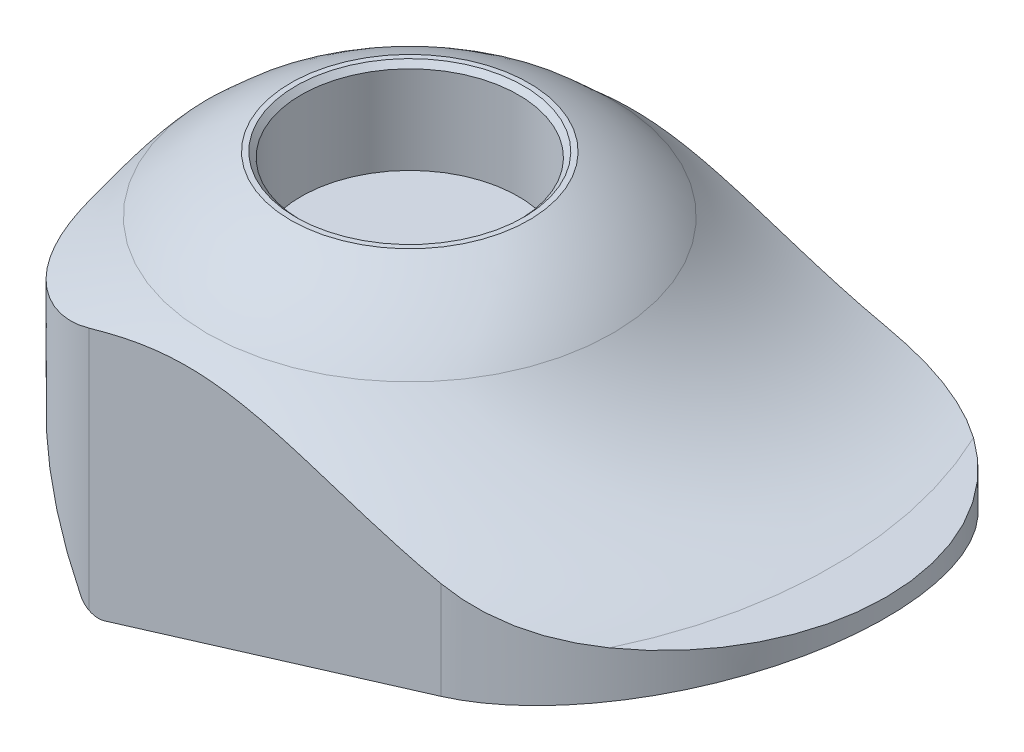
from build123d import *

# Parameters (mm, degrees)
IZIM2_OUTSIDE_W                      = 120.946
IZIM2_OUTSIDE_H                      = 120.946
KES_EKSTR_ZYON1_DEPTH                = 40
IZIM3_OUTSIDE_W                      = 84.664
IZIM3_OUTSIDE_H                      = 54.164
KES_EKSTR_ZYON2_DEPTH                = 30
Y_KSEKLIK_EKSTR_ZYON2_START          = 9
IZIM11_R                             = 10.5
Y_KSEKLIK_EKSTR_ZYON2_DEPTH          = 9
M8X1_25_DI_LI_DELIK1_D               = 6.8
M8X1_25_DI_LI_DELIK1_DEPTH           = 18
M8X1_25_DI_LI_DELIK1_TIP             = 2.042926105
M8X1_25_DI_LI_DELIK2_D               = 6.8
M8X1_25_DI_LI_DELIK2_DEPTH           = 12
M8X1_25_DI_LI_DELIK2_TIP             = 2.042926105
M8X1_25_DI_LI_DELIK2_ON_FACE_2_D     = 6.8
M8X1_25_DI_LI_DELIK2_ON_FACE_2_DEPTH = 12
M8X1_25_DI_LI_DELIK2_ON_FACE_2_TIP   = 2.042926105
KES_EKSTR_ZYON3_DEPTH                = 7


with BuildPart() as part:
    # Çizim1 → Döndür1 (revolve)
    with BuildSketch(Plane.XY, mode=Mode.PRIVATE) as d_nd_r1_sk:
        with BuildLine():
            Line((0, -35), (0, -18))
            Line((0, -18), (8.5, -18))
            Line((8.5, -18), (8.5, -9))
            Line((8.5, -9), (10.5, -9))
            Line((10.5, -9), (10.5, -0.5))
            Line((10.5, -0.5), (11, 0))
            Line((11, 0), (11.5, 0))
            ThreePointArc((11.5, 0), (15.803393463, -2.321536849), (19.572591816, -5.436319733))
            ThreePointArc((19.572591816, -5.436319733), (29.328522406, -11.988638081), (40.852954694, -14.290489038))
            Line((40.852954694, -14.290489038), (46, -14.290489038))
            Line((46, -14.290489038), (46, -35))
            Line((46, -35), (0, -35))
        make_face()
    revolve(d_nd_r1_sk.sketch.rotate(Axis((0, 4.884743134, 0), (0, -1, 0)), 90), axis=Axis((0, 4.884743134, 0), (0, -1, 0)))

    # Çizim2 outside → Kes-Ekstrüzyon1 (cut)
    with BuildSketch(Plane(origin=(0, 0, 0), x_dir=(1, 0, 0), z_dir=(0, 1, 0))):
        Rectangle(IZIM2_OUTSIDE_W, IZIM2_OUTSIDE_H)
        with BuildLine():
            Line((-19.5, 11.5), (-19.5, -11.5))
            ThreePointArc((-19.5, -11.5), (-16.571067812, -18.571067812), (-9.5, -21.5))
            Line((-9.5, -21.5), (24.5, -21.5))
            ThreePointArc((24.5, -21.5), (46, 0), (24.5, 21.5))
            Line((24.5, 21.5), (-9.5, 21.5))
            ThreePointArc((-9.5, 21.5), (-16.571067812, 18.571067812), (-19.5, 11.5))
        make_face(mode=Mode.SUBTRACT)
    extrude(amount=-KES_EKSTR_ZYON1_DEPTH, mode=Mode.SUBTRACT)

    # Çizim3 outside → Kes-Ekstrüzyon2 (cut, symmetric)
    with BuildSketch(Plane.XY):
        with Locations((13.25, -17.5)):
            Rectangle(IZIM3_OUTSIDE_W, IZIM3_OUTSIDE_H)
        with BuildLine():
            Line((-19.5, -13), (-19.5, -5.36356579))
            ThreePointArc((-19.5, -5.36356579), (-15.760740466, -2.292876744), (-11.5, 0))
            Line((-11.5, 0), (11.5, 0))
            ThreePointArc((11.5, 0), (15.803393463, -2.321536849), (19.572591816, -5.436319733))
            ThreePointArc((19.572591816, -5.436319733), (29.328522406, -11.988638081), (40.852954694, -14.290489038))
            Line((40.852954694, -14.290489038), (46, -14.290489038))
            Line((46, -14.290489038), (46, -16.000690448))
            Line((46, -16.000690448), (-7.993980308, -32.508306842))
            ThreePointArc((-7.993980308, -32.508306842), (-9.31172617, -32.456532466), (-10.310774525, -31.59569733))
            Line((-10.310774525, -31.59569733), (-18.160254038, -18))
            ThreePointArc((-18.160254038, -18), (-19.159258263, -15.588190451), (-19.5, -13))
        make_face(mode=Mode.SUBTRACT)
    extrude(amount=KES_EKSTR_ZYON2_DEPTH, both=True, mode=Mode.SUBTRACT)

    # Çizim11 → Yükseklik-Ekstrüzyon2 (add)
    with BuildSketch(Plane(origin=(0, -18, 0), x_dir=(1, 0, 0), z_dir=(0, 1, 0)).offset(Y_KSEKLIK_EKSTR_ZYON2_START)):
        with Locations(Location((0, 0, 0), (0, 0, 270))):
            Circle(IZIM11_R)
    extrude(amount=-Y_KSEKLIK_EKSTR_ZYON2_DEPTH)

    # M8x1.25 Dişli Delik1
    with Locations(Plane(origin=(-0.844028469, -30.322347194, 0), x_dir=(-0.956304755963, -0.292371704723, 0), z_dir=(0.292371704723, -0.956304755963, 0))):
        with Locations((0, 0)):
            Hole(M8X1_25_DI_LI_DELIK1_D / 2, depth=M8X1_25_DI_LI_DELIK1_DEPTH)
            with Locations((0, 0, -(M8X1_25_DI_LI_DELIK1_DEPTH + M8X1_25_DI_LI_DELIK1_TIP / 2))):  # 118° drill point
                Cone(0, M8X1_25_DI_LI_DELIK1_D / 2, M8X1_25_DI_LI_DELIK1_TIP, mode=Mode.SUBTRACT)

    # M8x1.25 Dişli Delik2
    with Locations(Plane(origin=(21.70506177, -23.428398469, 12.310096913), x_dir=(-0.956304755963, -0.292371704723, 0), z_dir=(0.292371704723, -0.956304755963, 0))):
        with Locations((0, 0)):
            Hole(M8X1_25_DI_LI_DELIK2_D / 2, depth=M8X1_25_DI_LI_DELIK2_DEPTH)
            with Locations((0, 0, -(M8X1_25_DI_LI_DELIK2_DEPTH + M8X1_25_DI_LI_DELIK2_TIP / 2))):  # 118° drill point
                Cone(0, M8X1_25_DI_LI_DELIK2_D / 2, M8X1_25_DI_LI_DELIK2_TIP, mode=Mode.SUBTRACT)

    # M8x1.25 Dişli Delik2 on face 2
    with Locations(Plane(origin=(21.70506177, -23.428398469, -12.310096913), x_dir=(-0.956304694265, -0.292371906527, 0), z_dir=(0.292371906527, -0.956304694265, 0))):
        with Locations((0, 0)):
            Hole(M8X1_25_DI_LI_DELIK2_ON_FACE_2_D / 2, depth=M8X1_25_DI_LI_DELIK2_ON_FACE_2_DEPTH)
            with Locations((0, 0, -(M8X1_25_DI_LI_DELIK2_ON_FACE_2_DEPTH + M8X1_25_DI_LI_DELIK2_ON_FACE_2_TIP / 2))):  # 118° drill point
                Cone(0, M8X1_25_DI_LI_DELIK2_ON_FACE_2_D / 2, M8X1_25_DI_LI_DELIK2_ON_FACE_2_TIP, mode=Mode.SUBTRACT)

    # Çizim16 → Kes-Ekstrüzyon3 (cut)
    with BuildSketch(Plane(origin=(8.405872106, -27.494368788, 0), x_dir=(0.956304755963042, 0.2923717047227155, 0), z_dir=(0.29237170472271556, -0.9563047559630421, 0))):
        with BuildLine():
            Line((-16.172544779, -8.831760866), (-16.172544779, -15.810096913))
            ThreePointArc((-16.172544779, -15.810096913), (-15.293865123, -17.931417256), (-13.172544779, -18.810096913))
            Line((-13.172544779, -18.810096913), (5.075092134, -18.810096913))
            ThreePointArc((5.075092134, -18.810096913), (7.556602709, -17.495951373), (7.864069249, -14.704833755))
            ThreePointArc((7.864069249, -14.704833755), (9.081050216, -7.955601822), (15.670169023, -6.053842714))
            ThreePointArc((15.670169023, -6.053842714), (23.208480374, -0.112690383), (15.891078456, 6.098513866))
            ThreePointArc((15.891078456, 6.098513866), (15.779783551, 6.080333222), (15.670169023, 6.053842714))
            ThreePointArc((15.670169023, 6.053842714), (9.081050216, 7.955601822), (7.864069249, 14.704833755))
            ThreePointArc((7.864069249, 14.704833755), (7.556602709, 17.495951374), (5.075092134, 18.810096913))
            Line((5.075092134, 18.810096913), (-13.172544779, 18.810096913))
            ThreePointArc((-13.172544779, 18.810096913), (-15.293865123, 17.931417256), (-16.172544779, 15.810096913))
            Line((-16.172544779, 15.810096913), (-16.172544779, 8.831760866))
            ThreePointArc((-16.172544779, 8.831760866), (-14.85839924, 6.350250291), (-12.067281621, 6.042783751))
            ThreePointArc((-12.067281621, 6.042783751), (-3.172544779, 0), (-12.067281621, -6.042783751))
            ThreePointArc((-12.067281621, -6.042783751), (-14.85839924, -6.350250291), (-16.172544779, -8.831760866))
        make_face()
    extrude(amount=-KES_EKSTR_ZYON3_DEPTH, mode=Mode.SUBTRACT)


solid = part.part
